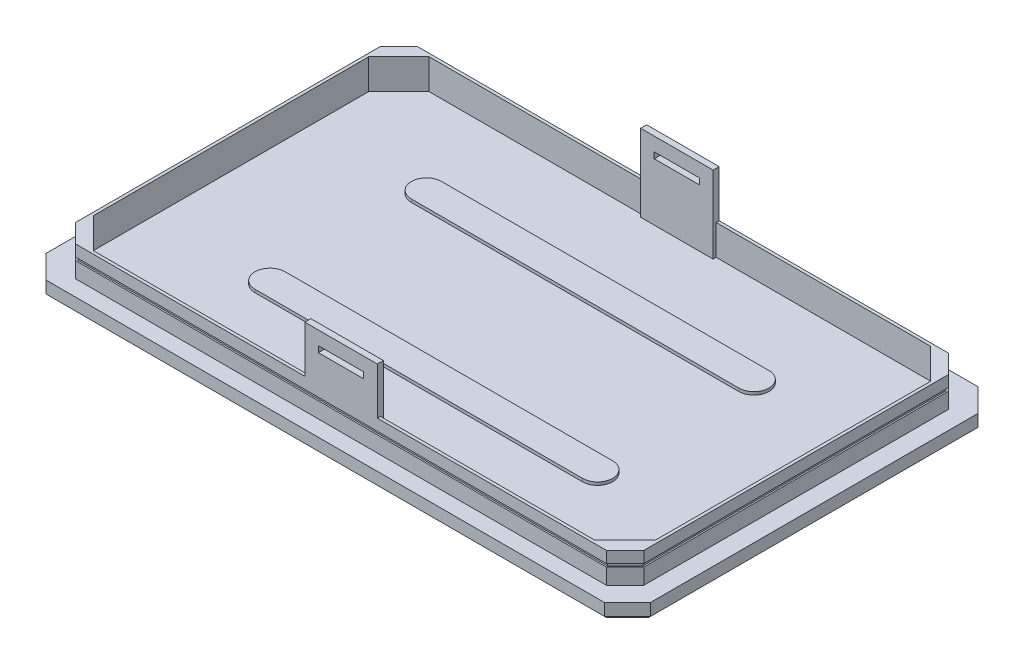
from build123d import *

# Parameters (mm, degrees)
EXTRUDE_1_DEPTH     = 5
EXTRUDE_2_DEPTH     = 10
SKETCH_6_W          = 9.821902293
SKETCH_6_H          = 0.385172639
CUT_EXTRUDE_2_DEPTH = 0.2
SKETCH_7_W          = 24
SKETCH_7_H          = 1
EXTRUDE_6_DEPTH     = 25.5
CUT_EXTRUDE_3_DEPTH = 1
CUT_EXTRUDE_6_DEPTH = 117.5
EXTRUDE_7_DEPTH     = 1
CHAMFER_3_SIZE      = 1


with BuildPart() as part:
    # 草图1 → 凸台-拉伸1 (new body)
    with BuildSketch(Plane(origin=(0, 0, 0), x_dir=(1, 0, 0), z_dir=(0, 1, 0))):
        Polygon((-100, 54.16), (-92.36, 61.8), (92.36, 61.8), (100, 54.16), (100, -54.16), (92.36, -61.8), (-92.36, -61.8), (-100, -54.16), align=None)
    extrude(amount=EXTRUDE_1_DEPTH)

    # 草图2 → 凸台-拉伸2 (add)
    with BuildSketch(Plane(origin=(0, 5, 0), x_dir=(1, 0, 0), z_dir=(0, 1, 0))):
        Polygon((-93.97, 50.37), (-87.79, 56.55), (87.79, 56.55), (93.97, 50.37), (93.97, -50.37), (87.79, -56.55), (-87.79, -56.55), (-93.97, -50.37), align=None)
        Polygon((-92.97, -45.55), (-82.97, -55.55), (82.97, -55.55), (92.97, -45.55), (92.97, 45.55), (82.97, 55.55), (-82.97, 55.55), (-92.97, 45.55), align=None, mode=Mode.SUBTRACT)
    extrude(amount=EXTRUDE_2_DEPTH)

    # 草图6 → 切除-拉伸2 (cut)
    with BuildSketch(Plane(origin=(72.17, 0, 72.17), x_dir=(0.7071067811865479, 0, -0.7071067811865471), z_dir=(0.7071067811865471, 0, 0.7071067811865479))):
        with Locations((26.350211631, 10.419075461)):
            Rectangle(SKETCH_6_W, SKETCH_6_H)
    extrude(amount=-CUT_EXTRUDE_2_DEPTH, mode=Mode.SUBTRACT)

    # 草图7 → 凸台-拉伸6 (add)
    with BuildSketch(Plane(origin=(0, 5, 0), x_dir=(1, 0, 0), z_dir=(0, 1, 0))):
        with Locations((0, 55.05)):
            Rectangle(SKETCH_7_W, SKETCH_7_H)
        with Locations((0, 56.05)):
            Rectangle(SKETCH_7_W, SKETCH_7_H)
        with Locations((0, -55.05)):
            Rectangle(SKETCH_7_W, SKETCH_7_H)
        with Locations((0, -56.05)):
            Rectangle(SKETCH_7_W, SKETCH_7_H)
    extrude(amount=EXTRUDE_6_DEPTH)

    # 草图5 → 切除-拉伸3 (cut)
    with BuildSketch(Plane(origin=(0, 10.226489141, 0), x_dir=(1, 0, 0), z_dir=(0, 1, 0))):
        Polygon((-87.79, -56.55), (87.79, -56.55), (93.97, -50.37), (93.97, 50.37), (87.79, 56.55), (-87.79, 56.55), (-93.97, 50.37), (-93.97, -50.37), align=None)
        Polygon((87.582893219, 56.05), (93.47, 50.162893219), (93.47, -50.162893219), (87.582893219, -56.05), (-87.582893219, -56.05), (-93.47, -50.162893219), (-93.47, 50.162893219), (-87.582893219, 56.05), align=None, mode=Mode.SUBTRACT)
    extrude(amount=CUT_EXTRUDE_3_DEPTH, mode=Mode.SUBTRACT)

    # 草图13 → 切除-拉伸6 (cut)
    with BuildSketch(Plane.XY.offset(56.55)):
        Polygon((0, 24), (7.5, 24), (7.5, 26), (-7.5, 26), (-7.5, 24), align=None)
    extrude(amount=-CUT_EXTRUDE_6_DEPTH, mode=Mode.SUBTRACT)

    # 草图17 → 凸台-拉伸7 (add)
    with BuildSketch(Plane(origin=(0, 5, 0), x_dir=(1, 0, 0), z_dir=(0, 1, 0))):
        with BuildLine():
            Line((-54.17, -20.86418044), (54.17, -20.86418044))
            ThreePointArc((54.17, -20.86418044), (59.17, -25.86418044), (54.17, -30.86418044))
            Line((54.17, -30.86418044), (-54.17, -30.86418044))
            ThreePointArc((-54.17, -30.86418044), (-59.17, -25.86418044), (-54.17, -20.86418044))
        make_face()
        with BuildLine():
            Line((-54.17, 20.86418044), (54.17, 20.86418044))
            ThreePointArc((54.17, 20.86418044), (59.17, 25.86418044), (54.17, 30.86418044))
            Line((54.17, 30.86418044), (-54.17, 30.86418044))
            ThreePointArc((-54.17, 30.86418044), (-59.17, 25.86418044), (-54.17, 20.86418044))
        make_face()
    extrude(amount=EXTRUDE_7_DEPTH)

    # 倒角3
    chamfer_3_edges = [part.edges().sort_by_distance(p)[0] for p in [
        (96.18, 0, 57.98),
        (0, 0, 61.8),
        (-96.18, 0, 57.98),
        (-100, 0, 0),
        (-96.18, 0, -57.98),
        (0, 0, -61.8),
        (96.18, 0, -57.98),
        (100, 0, 0),
    ]]
    chamfer(chamfer_3_edges, length=CHAMFER_3_SIZE)


solid = part.part
